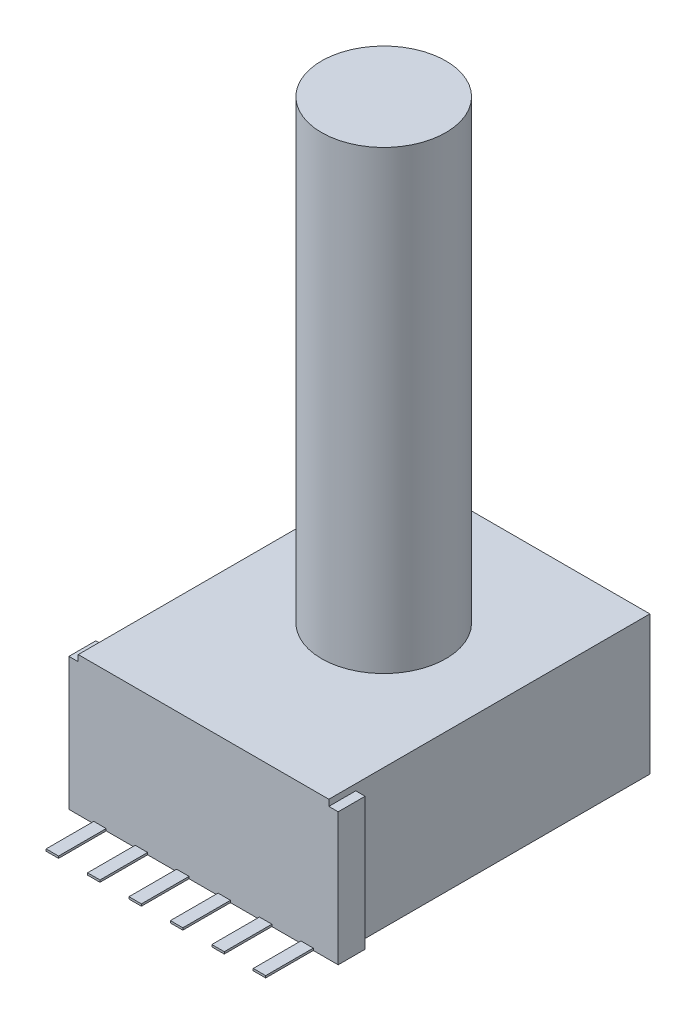
from build123d import *

# Parameters (mm, degrees)
SKETCH1_W      = 12.1
SKETCH1_H      = 15.5
EXTRUDE1_DEPTH = 6.7
SKETCH5_W      = 13
SKETCH5_H      = 1.3
EXTRUDE5_DEPTH = 6.4
SKETCH6_W      = 0.6
SKETCH6_H      = 2.3
EXTRUDE6_DEPTH = 0.1
SKETCH7_R      = 3
EXTRUDE7_DEPTH = 22


with BuildPart() as part:
    # Sketch1 → Extrude1 (new body)
    with BuildSketch(Plane(origin=(0, 0, 0), x_dir=(1, 0, 0), z_dir=(0, 1, 0))):
        with Locations((0, -0.95)):
            Rectangle(SKETCH1_W, SKETCH1_H)
    extrude(amount=EXTRUDE1_DEPTH)

    # Sketch5 → Extrude5 (add)
    with BuildSketch(Plane(origin=(0, 0, 0), x_dir=(1, 0, 0), z_dir=(0, 1, 0))):
        with Locations((0, -8.05)):
            Rectangle(SKETCH5_W, SKETCH5_H)
    extrude(amount=EXTRUDE5_DEPTH)

    # Sketch6 → Extrude6 (add)
    with BuildSketch(Plane(origin=(0, 0, 0), x_dir=(1, 0, 0), z_dir=(0, 1, 0))):
        with Locations((-1, -9.85)):
            Rectangle(SKETCH6_W, SKETCH6_H)
        with Locations((-3, -9.85)):
            Rectangle(SKETCH6_W, SKETCH6_H)
        with Locations((-5, -9.85)):
            Rectangle(SKETCH6_W, SKETCH6_H)
        with Locations((5, -9.85)):
            Rectangle(SKETCH6_W, SKETCH6_H)
        with Locations((3, -9.85)):
            Rectangle(SKETCH6_W, SKETCH6_H)
        with Locations((1, -9.85)):
            Rectangle(SKETCH6_W, SKETCH6_H)
    extrude(amount=EXTRUDE6_DEPTH)

    # Sketch7 → Extrude7 (add)
    with BuildSketch(Plane(origin=(0, 6.7, 0), x_dir=(1, 0, 0), z_dir=(0, 1, 0))):
        with Locations(Location((0, 0, 0), (0, 0, 270))):
            Circle(SKETCH7_R)
    extrude(amount=EXTRUDE7_DEPTH)


solid = part.part
